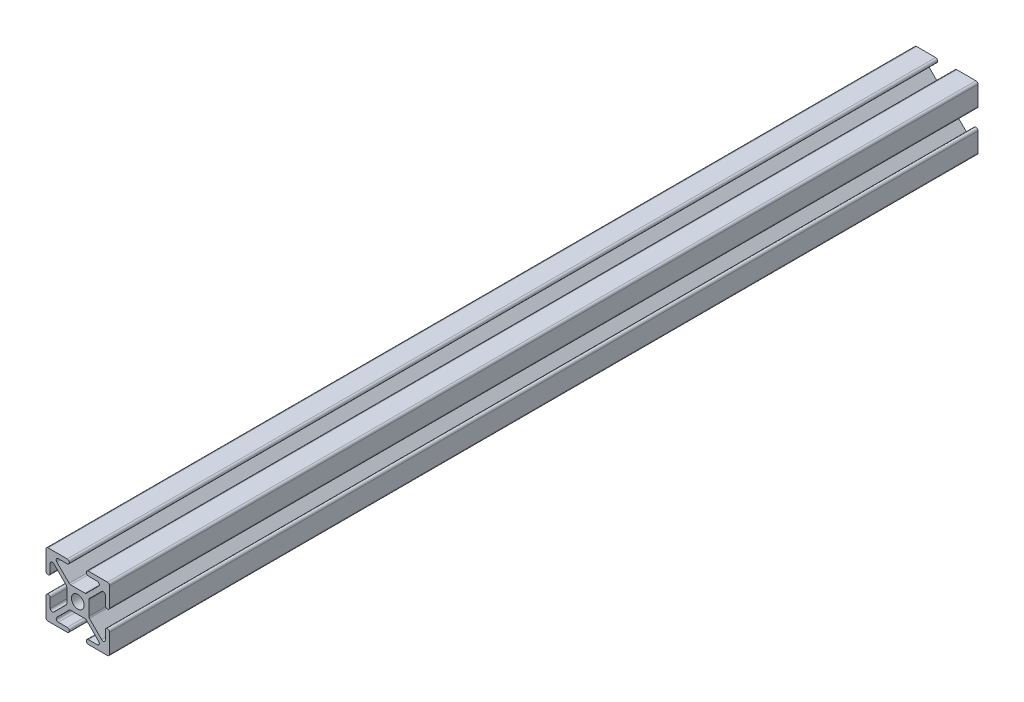
from build123d import *

# Parameters (mm, degrees)
SALIENTE_EXTRUIR1_DEPTH = 410
CROQUIS2_R              = 3
CORTAR_EXTRUIR1_DEPTH   = 411.54841371
CORTAR_EXTRUIR3_DEPTH   = 411.54841371


with BuildPart() as part:
    # Croquis1 → Saliente-Extruir1 (new body)
    with BuildSketch(Plane.XY):
        with BuildLine():
            Line((-14, 15), (14, 15))
            ThreePointArc((14, 15), (14.707106781, 14.707106781), (15, 14))
            Line((15, 14), (15, -14))
            ThreePointArc((15, -14), (14.707106781, -14.707106781), (14, -15))
            Line((14, -15), (-14, -15))
            ThreePointArc((-14, -15), (-14.707106781, -14.707106781), (-15, -14))
            Line((-15, -14), (-15, 14))
            ThreePointArc((-15, 14), (-14.707106781, 14.707106781), (-14, 15))
        make_face()
    extrude(amount=-SALIENTE_EXTRUIR1_DEPTH)

    # Croquis2 → Cortar-Extruir1 (cut, through all)
    with BuildSketch(Plane.XY):
        Circle(CROQUIS2_R)
    extrude(amount=-CORTAR_EXTRUIR1_DEPTH, mode=Mode.SUBTRACT)

    # Croquis3 → Cortar-Extruir3 (cut, through all)
    with BuildSketch(Plane.XY):
        with BuildLine():
            Line((-5.492893219, 4.078679656), (-11.292893219, 9.878679656))
            ThreePointArc((-11.292893219, 9.878679656), (-12.382683432, 10.095452408), (-13, 9.171572875))
            Line((-13, 9.171572875), (-13, 5))
            ThreePointArc((-13, 5), (-14, 4), (-15, 5))
            Line((-15, 5), (-15, -5))
            ThreePointArc((-15, -5), (-14, -4), (-13, -5))
            Line((-13, -5), (-13, -9.171572875))
            ThreePointArc((-13, -9.171572875), (-12.382683432, -10.095452408), (-11.292893219, -9.878679656))
            Line((-11.292893219, -9.878679656), (-5.492893219, -4.078679656))
            ThreePointArc((-5.492893219, -4.078679656), (-5.276120467, -3.754256308), (-5.2, -3.371572875))
            Line((-5.2, -3.371572875), (-5.2, 3.371572875))
            ThreePointArc((-5.2, 3.371572875), (-5.276120467, 3.754256308), (-5.492893219, 4.078679656))
        make_face()
        with BuildLine():
            ThreePointArc((-9.171572875, 13), (-10.095452408, 12.382683432), (-9.878679656, 11.292893219))
            Line((-9.878679656, 11.292893219), (-4.078679656, 5.492893219))
            ThreePointArc((-4.078679656, 5.492893219), (-3.754256308, 5.276120467), (-3.371572875, 5.2))
            Line((-3.371572875, 5.2), (3.371572875, 5.2))
            ThreePointArc((3.371572875, 5.2), (3.754256308, 5.276120467), (4.078679656, 5.492893219))
            Line((4.078679656, 5.492893219), (9.878679656, 11.292893219))
            ThreePointArc((9.878679656, 11.292893219), (10.095452408, 12.382683432), (9.171572875, 13))
            Line((9.171572875, 13), (5, 13))
            ThreePointArc((5, 13), (4, 14), (5, 15))
            Line((5, 15), (-5, 15))
            ThreePointArc((-5, 15), (-4.292893219, 14.707106781), (-4, 14))
            ThreePointArc((-4, 14), (-4.292893219, 13.292893219), (-5, 13))
            Line((-5, 13), (-9.171572875, 13))
        make_face()
        with BuildLine():
            Line((9.878679656, -11.292893219), (4.078679656, -5.492893219))
            ThreePointArc((4.078679656, -5.492893219), (3.754256308, -5.276120467), (3.371572875, -5.2))
            Line((3.371572875, -5.2), (-3.371572875, -5.2))
            ThreePointArc((-3.371572875, -5.2), (-3.754256308, -5.276120467), (-4.078679656, -5.492893219))
            Line((-4.078679656, -5.492893219), (-9.878679656, -11.292893219))
            ThreePointArc((-9.878679656, -11.292893219), (-10.095452408, -12.382683432), (-9.171572875, -13))
            Line((-9.171572875, -13), (-5, -13))
            ThreePointArc((-5, -13), (-4.292893219, -13.292893219), (-4, -14))
            ThreePointArc((-4, -14), (-4.292893219, -14.707106781), (-5, -15))
            Line((-5, -15), (5, -15))
            ThreePointArc((5, -15), (4, -14), (5, -13))
            Line((5, -13), (9.171572875, -13))
            ThreePointArc((9.171572875, -13), (10.095452408, -12.382683432), (9.878679656, -11.292893219))
        make_face()
        with BuildLine():
            ThreePointArc((13, 9.171572875), (12.382683432, 10.095452408), (11.292893219, 9.878679656))
            Line((11.292893219, 9.878679656), (5.492893219, 4.078679656))
            ThreePointArc((5.492893219, 4.078679656), (5.276120467, 3.754256308), (5.2, 3.371572875))
            Line((5.2, 3.371572875), (5.2, -3.371572875))
            ThreePointArc((5.2, -3.371572875), (5.276120467, -3.754256308), (5.492893219, -4.078679656))
            Line((5.492893219, -4.078679656), (11.292893219, -9.878679656))
            ThreePointArc((11.292893219, -9.878679656), (12.382683432, -10.095452408), (13, -9.171572875))
            Line((13, -9.171572875), (13, -5))
            ThreePointArc((13, -5), (14, -4), (15, -5))
            Line((15, -5), (15, 5))
            ThreePointArc((15, 5), (14, 4), (13, 5))
            Line((13, 5), (13, 9.171572875))
        make_face()
    extrude(amount=-CORTAR_EXTRUIR3_DEPTH, mode=Mode.SUBTRACT)


solid = part.part
